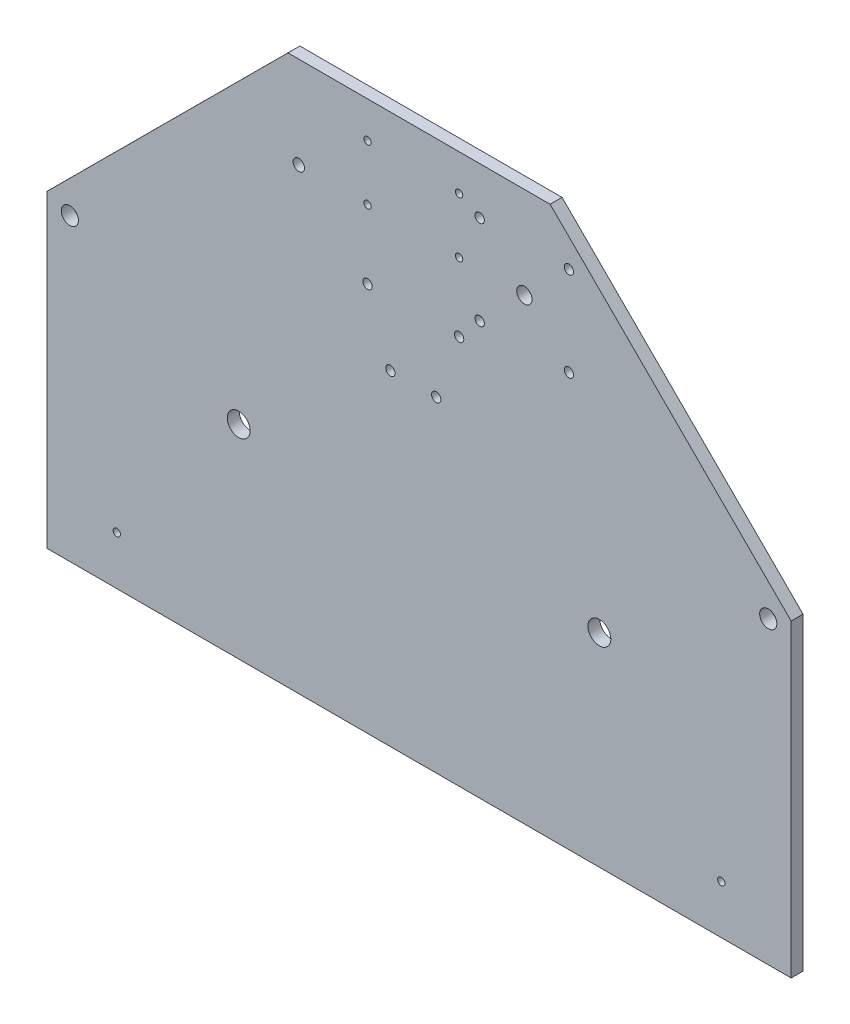
from build123d import *

# Parameters (mm, degrees)
REFERENCE_R            = 6.35
REFERENCE_R_2          = 3.175
REFERENCE_R_3          = 4.2545
BOSS_EXTRUDE3_DEPTH    = 6.604
F_10_32_TAPPED_HOLE1_D = 4.0386
SKETCH3_R              = 2.5796875
CUT_EXTRUDE1_DEPTH     = 369.153899125
SKETCH4_R              = 2.5796875
CUT_EXTRUDE2_DEPTH     = 369.153899125
SKETCH5_R              = 4.7625
CUT_EXTRUDE3_DEPTH     = 369.153899125


with BuildPart() as part:
    # reference → Boss-Extrude3 (new body)
    with BuildSketch(Plane.XY):
        Polygon((206.375, 0), (-206.375, 0), (-206.375, 171.45), (-72.7075, 304.8), (72.7075, 304.8), (206.375, 171.45), align=None)
        with Locations(Location((-100.0125, 112.7125, 0), (0, 0, 180))):
            Circle(REFERENCE_R, mode=Mode.SUBTRACT)
        with Locations(Location((100.0125, 112.7125, 0), (0, 0, 180))):
            Circle(REFERENCE_R, mode=Mode.SUBTRACT)
        with Locations(Location((-66.675, 254, 0), (0, 0, 180))):
            Circle(REFERENCE_R_2, mode=Mode.SUBTRACT)
        with Locations(Location((58.42, 254, 0), (0, 0, 180))):
            Circle(REFERENCE_R_3, mode=Mode.SUBTRACT)
    extrude(amount=BOSS_EXTRUDE3_DEPTH)

    # #10-32 Tapped Hole1 (through all)
    with Locations(Plane.XY.offset(6.604)):
        with Locations((-167.64, 26.9875), (167.64, 27.0002), (-28.575, 284.734), (22.225, 284.734), (-28.575, 254), (22.225, 254)):
            Hole(F_10_32_TAPPED_HOLE1_D / 2)

    # Sketch3 → Cut-Extrude1 (cut, through all)
    with BuildSketch(Plane(origin=(0, 0, 0), x_dir=(-1, 0, 0), z_dir=(0, 0, -1))):
        with Locations((-33.62112915, 278.748737342)):
            Circle(SKETCH3_R)
        with Locations((-33.62112915, 229.251262658)):
            Circle(SKETCH3_R)
        with Locations((-83.118603833, 229.251262658)):
            Circle(SKETCH3_R)
        with Locations((-83.118603833, 278.748737342)):
            Circle(SKETCH3_R)
    extrude(amount=-CUT_EXTRUDE1_DEPTH, mode=Mode.SUBTRACT)

    # Sketch4 → Cut-Extrude2 (cut, through all)
    with BuildSketch(Plane.XY.offset(6.604)):
        with Locations((-28.575, 215.9)):
            Circle(SKETCH4_R)
        with Locations((22.225, 215.9)):
            Circle(SKETCH4_R)
        with Locations((-15.875, 180.594)):
            Circle(SKETCH4_R)
        with Locations((9.525, 180.594)):
            Circle(SKETCH4_R)
    extrude(amount=-CUT_EXTRUDE2_DEPTH, mode=Mode.SUBTRACT)

    # Sketch5 → Cut-Extrude3 (cut, through all)
    with BuildSketch(Plane(origin=(0, 0, 0), x_dir=(-1, 0, 0), z_dir=(0, 0, -1))):
        with Locations((-193.675, 166.18063958)):
            Circle(SKETCH5_R)
        with Locations(Location((193.675, 166.18063958, 0), (0, 0, 180))):
            Circle(SKETCH5_R)
    extrude(amount=-CUT_EXTRUDE3_DEPTH, mode=Mode.SUBTRACT)


solid = part.part
